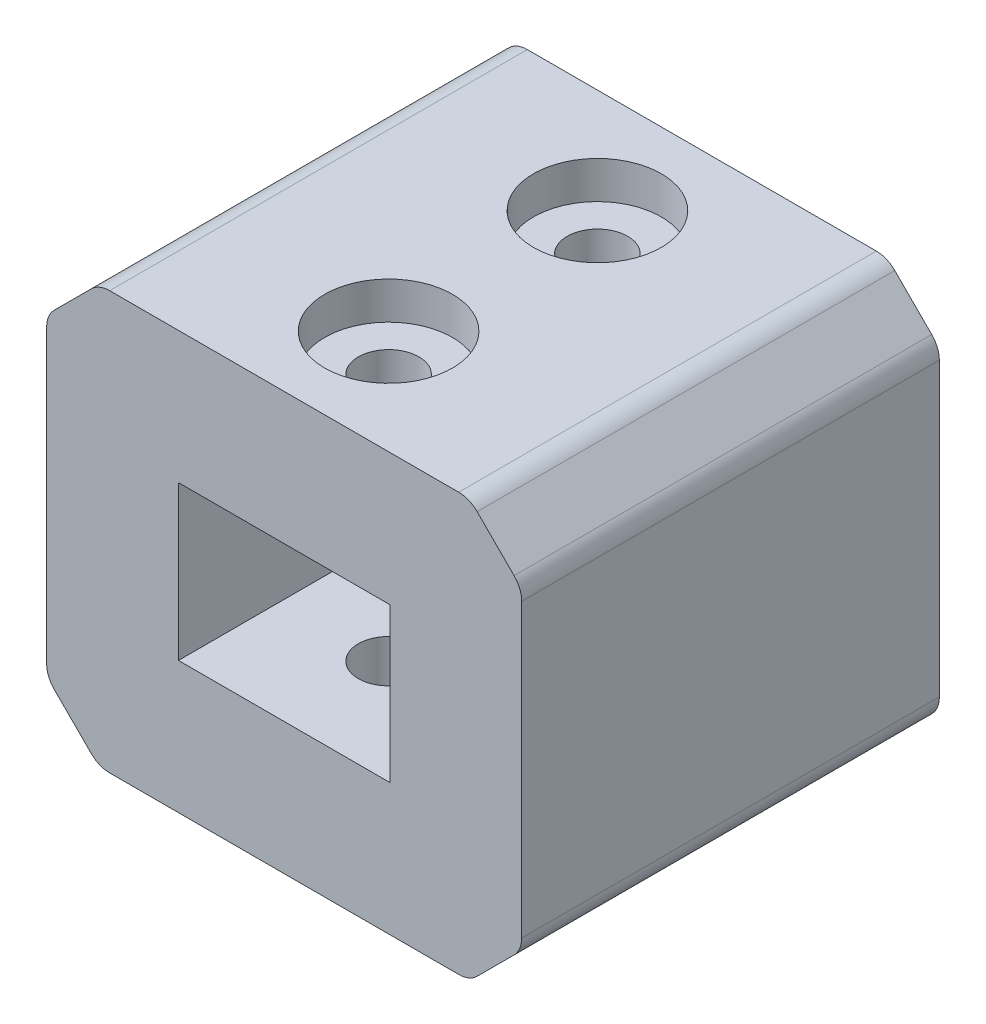
from build123d import *

# Parameters (mm, degrees)
SKETCH1_W                               = 45.5
SKETCH1_H                               = 40
SKETCH1_W_2                             = 20.25
SKETCH1_H_2                             = 14.75
BOSS_EXTRUDE1_DEPTH                     = 40
CHAMFER1_SIZE                           = 5
FILLET1_R                               = 2.5
CBORE_FOR_M5_HEX_HEAD_BOLT1_D           = 5.8
CBORE_FOR_M5_HEX_HEAD_BOLT1_CBORE_D     = 12.24
CBORE_FOR_M5_HEX_HEAD_BOLT1_CBORE_DEPTH = 3.58


with BuildPart() as part:
    # Sketch1 → Boss-Extrude1 (new body)
    with BuildSketch(Plane.XY):
        Rectangle(SKETCH1_W, SKETCH1_H)
        Rectangle(SKETCH1_W_2, SKETCH1_H_2, mode=Mode.SUBTRACT)
    extrude(amount=BOSS_EXTRUDE1_DEPTH)

    # Chamfer1
    chamfer1_edges = [part.edges().sort_by_distance(p)[0] for p in [
        (22.75, -20, 20),
        (-22.75, -20, 20),
        (-22.75, 20, 20),
        (22.75, 20, 20),
    ]]
    chamfer(chamfer1_edges, length=CHAMFER1_SIZE)

    # Fillet1
    fillet1_edges = [part.edges().sort_by_distance(p)[0] for p in [
        (-17.75, 20, 20),
        (17.75, 20, 20),
        (22.75, -15, 20),
        (22.75, 15, 20),
        (-17.75, -20, 20),
        (17.75, -20, 20),
        (-22.75, 15, 20),
        (-22.75, -15, 20),
    ]]
    fillet(fillet1_edges, radius=FILLET1_R)

    # CBORE for M5 Hex Head Bolt1 (through all)
    with Locations(Plane(origin=(0, 20, 0), x_dir=(1, 0, 0), z_dir=(0, 1, 0))):
        with Locations((0, -10)):
            cbore_for_m5_hex_head_bolt1 = CounterBoreHole(CBORE_FOR_M5_HEX_HEAD_BOLT1_D / 2, CBORE_FOR_M5_HEX_HEAD_BOLT1_CBORE_D / 2, CBORE_FOR_M5_HEX_HEAD_BOLT1_CBORE_DEPTH)

    # Mirror1: CBORE for M5 Hex Head Bolt1 across plane
    add(cbore_for_m5_hex_head_bolt1.mirror(Plane(origin=(0, 0, 20), x_dir=(1, 0, 0), z_dir=(0, 0, -1))), mode=Mode.SUBTRACT)


solid = part.part
